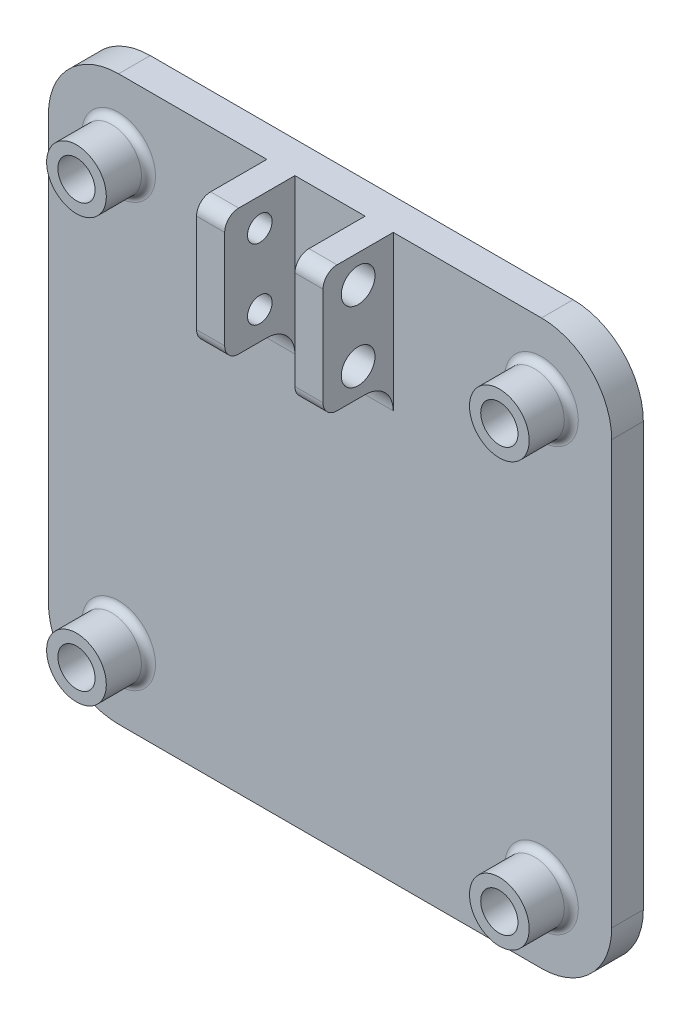
from build123d import *

# Parameters (mm, degrees)
SKETCH1_W            = 80.2
SKETCH1_H            = 80.2
BOSS_EXTRUDE1_DEPTH  = 4.5
M5_CLEARANCE_HOLE1_D = 5.3
FILLET1_R            = 10
SKETCH3_W            = 4
SKETCH3_H            = 18
BOSS_EXTRUDE2_DEPTH  = 10
CUT_EXTRUDE1_REACH   = 67.031
SKETCH5_R            = 2.4
CUT_EXTRUDE2_REACH   = 67.031
SKETCH6_R            = 1.75
FILLET2_R            = 2
FILLET3_R            = 4
BOSS_EXTRUDE3_START  = 6
SKETCH7_R            = 4.25
SKETCH7_R_2          = 2.65
BOSS_EXTRUDE3_DEPTH  = 6
FILLET5_R            = 1


with BuildPart() as part:
    # Sketch1 → Boss-Extrude1 (new body)
    with BuildSketch(Plane.XY):
        Rectangle(SKETCH1_W, SKETCH1_H)
    extrude(amount=BOSS_EXTRUDE1_DEPTH)

    # M5 Clearance Hole1 (through all)
    with Locations(Plane(origin=(30.1, 30.1, 0), x_dir=(-1, 0, 0), z_dir=(0, 0, -1))):
        with Locations((0, 0), (60.2, 0), (60.2, -60.2), (0, -60.2)):
            Hole(M5_CLEARANCE_HOLE1_D / 2)

    # Fillet1
    fillet1_edges = [part.edges().sort_by_distance(p)[0] for p in [
        (-40.1, -40.1, 2.25),
        (-40.1, 40.1, 2.25),
        (40.1, 40.1, 2.25),
        (40.1, -40.1, 2.25),
    ]]
    fillet(fillet1_edges, radius=FILLET1_R)

    # Sketch3 → Boss-Extrude2 (add)
    with BuildSketch(Plane.XY.offset(4.5)):
        with Locations((-7, 31.1)):
            Rectangle(SKETCH3_W, SKETCH3_H)
        with Locations((7, 31.1)):
            Rectangle(SKETCH3_W, SKETCH3_H)
    extrude(amount=BOSS_EXTRUDE2_DEPTH)

    # Sketch5 → Cut-Extrude1 (cut, up to next)
    with BuildSketch(Plane(origin=(9, 0, 0), x_dir=(0, 0, -1), z_dir=(1, 0, 0)), mode=Mode.PRIVATE) as cut_extrude1_sk1:
        with Locations(Location((-9.5, 36.1, 0), (0, 0, 90))):
            Circle(SKETCH5_R)
    cut_extrude1_tool1 = extrude(cut_extrude1_sk1.sketch, amount=-CUT_EXTRUDE1_REACH, mode=Mode.PRIVATE) & part.part
    # Sketch5 → Cut-Extrude1 (cut, up to next)
    with BuildSketch(Plane(origin=(9, 0, 0), x_dir=(0, 0, -1), z_dir=(1, 0, 0)), mode=Mode.PRIVATE) as cut_extrude1_sk2:
        with Locations(Location((-9.5, 26.1, 0), (0, 0, 90))):
            Circle(SKETCH5_R)
    cut_extrude1_tool2 = extrude(cut_extrude1_sk2.sketch, amount=-CUT_EXTRUDE1_REACH, mode=Mode.PRIVATE) & part.part
    add(cut_extrude1_tool1.solids().sort_by_distance((9, 36.1, 9.5))[0], mode=Mode.SUBTRACT)
    add(cut_extrude1_tool2.solids().sort_by_distance((9, 26.1, 9.5))[0], mode=Mode.SUBTRACT)

    # Sketch6 → Cut-Extrude2 (cut, up to next)
    with BuildSketch(Plane.ZY.offset(9), mode=Mode.PRIVATE) as cut_extrude2_sk1:
        with Locations((9.5, 36.1)):
            Circle(SKETCH6_R)
    cut_extrude2_tool1 = extrude(cut_extrude2_sk1.sketch, amount=-CUT_EXTRUDE2_REACH, mode=Mode.PRIVATE) & part.part
    # Sketch6 → Cut-Extrude2 (cut, up to next)
    with BuildSketch(Plane.ZY.offset(9), mode=Mode.PRIVATE) as cut_extrude2_sk2:
        with Locations((9.5, 26.1)):
            Circle(SKETCH6_R)
    cut_extrude2_tool2 = extrude(cut_extrude2_sk2.sketch, amount=-CUT_EXTRUDE2_REACH, mode=Mode.PRIVATE) & part.part
    add(cut_extrude2_tool1.solids().sort_by_distance((-9, 36.1, 9.5))[0], mode=Mode.SUBTRACT)
    add(cut_extrude2_tool2.solids().sort_by_distance((-9, 26.1, 9.5))[0], mode=Mode.SUBTRACT)

    # Fillet2
    fillet2_edges = [part.edges().sort_by_distance(p)[0] for p in [
        (-7, 22.1, 14.5),
        (-7, 40.1, 14.5),
        (7, 40.1, 14.5),
        (7, 22.1, 14.5),
    ]]
    fillet(fillet2_edges, radius=FILLET2_R)

    # Fillet3
    fillet3_edges = [part.edges().sort_by_distance(p)[0] for p in [
        (-7, 22.1, 4.5),
        (7, 22.1, 4.5),
    ]]
    fillet(fillet3_edges, radius=FILLET3_R)

    # Sketch7 → Boss-Extrude3 (add)
    # profile 1 of 4: a face of its own
    with BuildSketch(Plane.XY.offset(4.5).offset(BOSS_EXTRUDE3_START)):
        with Locations((-30.1, 30.1)):
            Circle(SKETCH7_R)
        with Locations(Location((-30.1, 30.1, 0), (0, 0, 180))):
            Circle(SKETCH7_R_2, mode=Mode.SUBTRACT)
    # profile 2 of 4: a face of its own
    with BuildSketch(Plane.XY.offset(4.5).offset(BOSS_EXTRUDE3_START)):
        with Locations((30.1, 30.1)):
            Circle(SKETCH7_R)
        with Locations(Location((30.1, 30.1, 0), (0, 0, 180))):
            Circle(SKETCH7_R_2, mode=Mode.SUBTRACT)
    # profile 3 of 4: a face of its own
    with BuildSketch(Plane.XY.offset(4.5).offset(BOSS_EXTRUDE3_START)):
        with Locations((30.1, -30.1)):
            Circle(SKETCH7_R)
        with Locations(Location((30.1, -30.1, 0), (0, 0, 180))):
            Circle(SKETCH7_R_2, mode=Mode.SUBTRACT)
    # profile 4 of 4: a face of its own
    with BuildSketch(Plane.XY.offset(4.5).offset(BOSS_EXTRUDE3_START)):
        with Locations((-30.1, -30.1)):
            Circle(SKETCH7_R)
        with Locations(Location((-30.1, -30.1, 0), (0, 0, 180))):
            Circle(SKETCH7_R_2, mode=Mode.SUBTRACT)
    extrude(amount=-BOSS_EXTRUDE3_DEPTH)

    # Fillet5
    fillet5_edges = [part.edges().sort_by_distance(p)[0] for p in [
        (-34.35, 30.1, 4.5),
        (25.85, 30.1, 4.5),
        (25.85, -30.1, 4.5),
        (-34.35, -30.1, 4.5),
    ]]
    fillet(fillet5_edges, radius=FILLET5_R)


solid = part.part
